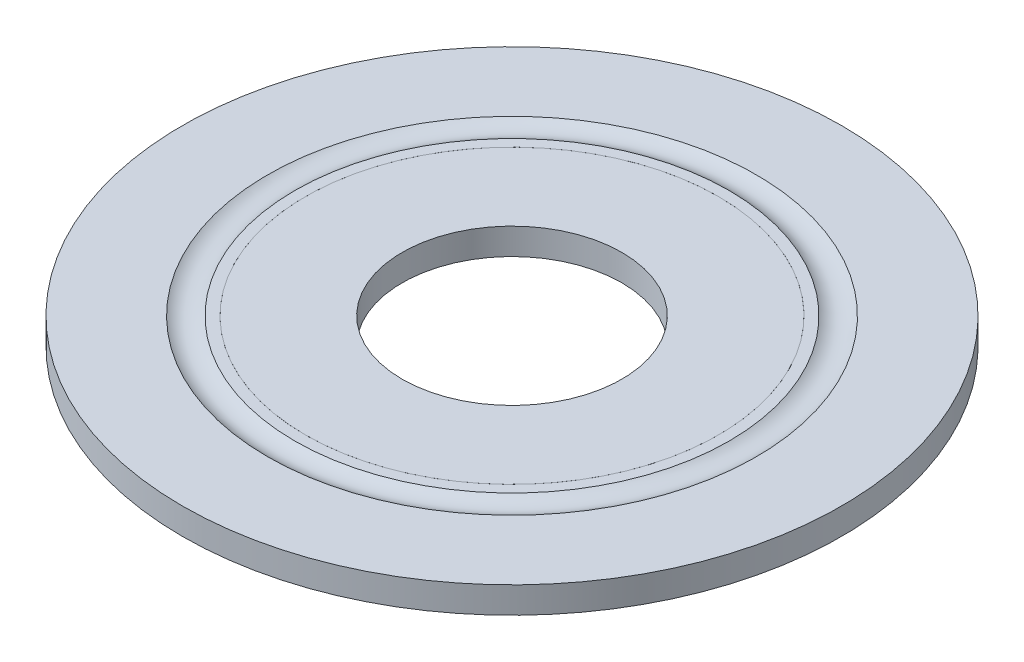
from build123d import *

# Parameters (mm, degrees)
SKETCH2_R           = 75
SKETCH2_R_2         = 59
SKETCH2_R_3         = 46.992946112
BOSS_EXTRUDE1_DEPTH = 6
SKETCH8_R           = 25
CUT_EXTRUDE4_DEPTH  = 6


with BuildPart() as part:
    # Sketch1 → Revolve1 (revolve)
    with BuildSketch(Plane(origin=(0, 0, 0), x_dir=(-1, 0, 0), z_dir=(0, 0, -1)), mode=Mode.PRIVATE) as revolve1_sk:
        with BuildLine():
            Line((-59, 0.8724), (-47, 0.8724))
            ThreePointArc((-47, 0.8724), (-46.292893219, 1.165293219), (-46, 1.8724))
            Line((-46, 1.8724), (-46, 5.8724))
            Line((-46, 5.8724), (-47, 6.8724))
            Line((-47, 6.8724), (-49.4043, 6.8724))
            ThreePointArc((-49.4043, 6.8724), (-52.5, 5.8405), (-55.5957, 6.8724))
            Line((-55.5957, 6.8724), (-59, 6.8724))
            Line((-59, 6.8724), (-60, 5.8724))
            Line((-60, 5.8724), (-60, 1.8724))
            ThreePointArc((-60, 1.8724), (-59.707106781, 1.165293219), (-59, 0.8724))
        make_face()
    revolve(revolve1_sk.sketch.rotate(Axis((0, 0, 0), (0, 1, 0)), 270), axis=Axis((0, 0, 0), (0, 1, 0)))

    # Sketch2 → Boss-Extrude1 (add)
    # profile 1 of 2: a face of its own
    with BuildSketch(Plane.XZ.offset(-0.8724)):
        with Locations(Location((0, 0, 0), (0, 0, 270))):
            Circle(SKETCH2_R)
        Circle(SKETCH2_R_2, mode=Mode.SUBTRACT)
    # profile 2 of 2: a face of its own
    with BuildSketch(Plane.XZ.offset(-0.8724)):
        with Locations(Location((0, 0, 0), (0, 0, 270))):
            Circle(SKETCH2_R_3)
    extrude(amount=-BOSS_EXTRUDE1_DEPTH)

    # Sketch8 → Cut-Extrude4 (cut)
    with BuildSketch(Plane(origin=(0, 6.8724, 0), x_dir=(1, 0, 0), z_dir=(0, 1, 0))):
        with Locations(Location((0, 0, 0), (0, 0, 270))):
            Circle(SKETCH8_R)
    extrude(amount=-CUT_EXTRUDE4_DEPTH, mode=Mode.SUBTRACT)


solid = part.part
